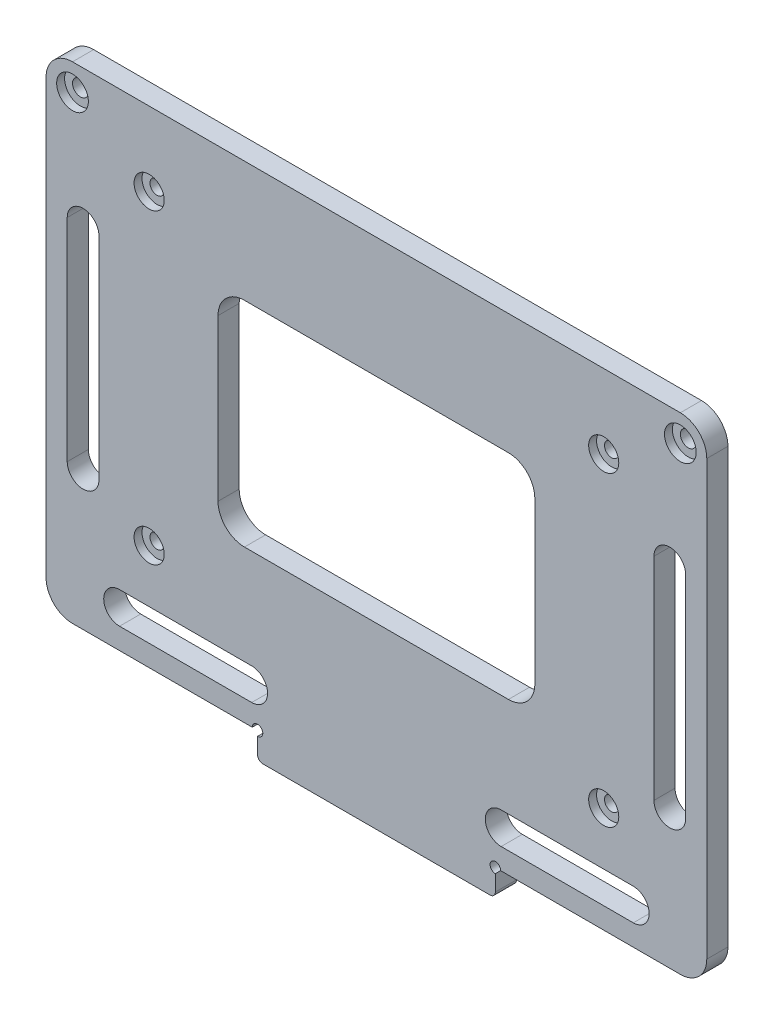
from build123d import *

# Parameters (mm, degrees)
SKETCH_1_W          = 45
SKETCH_1_H          = 5
EXTRUDE_1_DEPTH     = 4
SKETCH_2_W          = 125
SKETCH_2_H          = 92.025
SKETCH_2_R          = 1.5
SKETCH_2_R_2        = 1.35
SKETCH_2_W_2        = 59.93870536
SKETCH_2_H_2        = 40.423778034
SKETCH_2_W_3        = 45
SKETCH_2_H_3        = 5
EXTRUDE_2_DEPTH     = 4
CUT_EXTRUDE_1_DEPTH = 4
FILLET_1_R          = 5
FILLET_2_R          = 1
CUT_EXTRUDE_START   = -1.5
SKETCH_4_R          = 2.85
SKETCH_4_R_2        = 1.35
SKETCH_4_R_3        = 3
SKETCH_4_R_4        = 1.5
CUT_EXTRUDE_2_DEPTH = 1.5


with BuildPart() as part:
    # 草图1 → 凸台-拉伸1 (new body)
    with BuildSketch(Plane.XY):
        Rectangle(SKETCH_1_W, SKETCH_1_H)
    extrude(amount=EXTRUDE_1_DEPTH)

    # 草图2 → 凸台-拉伸2 (add)
    # profile 1 of 2: a face of its own
    with BuildSketch(Plane(origin=(0, 0, 0), x_dir=(-1, 0, 0), z_dir=(0, 0, -1))):
        with Locations((0, 48.5125)):
            Rectangle(SKETCH_2_W, SKETCH_2_H)
        with Locations((-57.5, 89.525)):
            Circle(SKETCH_2_R, mode=Mode.SUBTRACT)
        with Locations((57.5, 89.525)):
            Circle(SKETCH_2_R, mode=Mode.SUBTRACT)
        with Locations((-43, 80.5)):
            Circle(SKETCH_2_R_2, mode=Mode.SUBTRACT)
        with Locations((43, 80.5)):
            Circle(SKETCH_2_R_2, mode=Mode.SUBTRACT)
        with Locations((43, 22.5)):
            Circle(SKETCH_2_R_2, mode=Mode.SUBTRACT)
        with Locations((-43, 22.5)):
            Circle(SKETCH_2_R_2, mode=Mode.SUBTRACT)
        with BuildLine():
            Line((-52.5, 68.5125), (-52.5, 28.5125))
            ThreePointArc((-52.5, 28.5125), (-55.5, 25.5125), (-58.5, 28.5125))
            Line((-58.5, 28.5125), (-58.5, 68.5125))
            ThreePointArc((-58.5, 68.5125), (-55.5, 71.5125), (-52.5, 68.5125))
        make_face(mode=Mode.SUBTRACT)
        with BuildLine():
            Line((58.5, 68.5125), (58.5, 28.5125))
            ThreePointArc((58.5, 28.5125), (55.5, 25.5125), (52.5, 28.5125))
            Line((52.5, 28.5125), (52.5, 68.5125))
            ThreePointArc((52.5, 68.5125), (55.5, 71.5125), (58.5, 68.5125))
        make_face(mode=Mode.SUBTRACT)
        with Locations((0, 51.5)):
            Rectangle(SKETCH_2_W_2, SKETCH_2_H_2, mode=Mode.SUBTRACT)
        with BuildLine():
            Line((-48.597194221, 12.5), (-23.597194221, 12.5))
            ThreePointArc((-23.597194221, 12.5), (-20.597194221, 9.5), (-23.597194221, 6.5))
            Line((-23.597194221, 6.5), (-48.597194221, 6.5))
            ThreePointArc((-48.597194221, 6.5), (-51.597194221, 9.5), (-48.597194221, 12.5))
        make_face(mode=Mode.SUBTRACT)
        with BuildLine():
            Line((48.597194221, 12.5), (23.597194221, 12.5))
            ThreePointArc((23.597194221, 12.5), (20.597194221, 9.5), (23.597194221, 6.5))
            Line((23.597194221, 6.5), (48.597194221, 6.5))
            ThreePointArc((48.597194221, 6.5), (51.597194221, 9.5), (48.597194221, 12.5))
        make_face(mode=Mode.SUBTRACT)
    # profile 2 of 2: a face of its own
    with BuildSketch(Plane(origin=(0, 0, 0), x_dir=(-1, 0, 0), z_dir=(0, 0, -1))):
        Rectangle(SKETCH_2_W_3, SKETCH_2_H_3)
    extrude(amount=-EXTRUDE_2_DEPTH)

    # 草图3 → 切除-拉伸1 (cut)
    with BuildSketch(Plane(origin=(0, 0, 0), x_dir=(-1, 0, 0), z_dir=(0, 0, -1))):
        with BuildLine():
            Line((-23.5, 2.5), (-22.5, 2.5))
            Line((-22.5, 2.5), (-22.5, 1.5))
            ThreePointArc((-22.5, 1.5), (-21.792893219, 1.792893219), (-21.5, 2.5))
            ThreePointArc((-21.5, 2.5), (-22.5, 3.5), (-23.5, 2.5))
        make_face()
        with BuildLine():
            Line((-22.5, 1.5), (-22.5, 2.5))
            Line((-22.5, 2.5), (-23.5, 2.5))
            ThreePointArc((-23.5, 2.5), (-23.207106781, 1.792893219), (-22.5, 1.5))
        make_face()
        with BuildLine():
            ThreePointArc((23.5, 2.5), (21.792893219, 3.207106781), (22.5, 1.5))
            Line((22.5, 1.5), (22.5, 2.5))
            Line((22.5, 2.5), (23.5, 2.5))
        make_face()
        with BuildLine():
            Line((22.5, 2.5), (22.5, 1.5))
            ThreePointArc((22.5, 1.5), (23.207106781, 1.792893219), (23.5, 2.5))
            Line((23.5, 2.5), (22.5, 2.5))
        make_face()
    extrude(amount=-CUT_EXTRUDE_1_DEPTH, mode=Mode.SUBTRACT)

    # 圆角1
    fillet_1_edges = [part.edges().sort_by_distance(p)[0] for p in [
        (-62.5, 2.5, 2),
        (-29.96935268, 71.711889017, 2),
        (29.96935268, 71.711889017, 2),
        (29.96935268, 31.288110983, 2),
        (62.5, 94.525, 2),
        (-62.5, 94.525, 2),
        (-29.96935268, 31.288110983, 2),
        (62.5, 2.5, 2),
    ]]
    fillet(fillet_1_edges, radius=FILLET_1_R)

    # 圆角2
    fillet_2_edges = [part.edges().sort_by_distance(p)[0] for p in [
        (22.5, -2.5, 2),
        (-22.5, -2.5, 2),
    ]]
    fillet(fillet_2_edges, radius=FILLET_2_R)

    # 草图4 → 切除-拉伸2 (cut)
    # profile 1 of 6: a face of its own
    with BuildSketch(Plane.XY.offset(4).offset(CUT_EXTRUDE_START)):
        with Locations((43, 22.5)):
            Circle(SKETCH_4_R)
        with Locations(Location((43, 22.5, 0), (0, 0, 180))):
            Circle(SKETCH_4_R_2, mode=Mode.SUBTRACT)
    # profile 2 of 6: a face of its own
    with BuildSketch(Plane.XY.offset(4).offset(CUT_EXTRUDE_START)):
        with Locations((43, 80.5)):
            Circle(SKETCH_4_R)
        with Locations(Location((43, 80.5, 0), (0, 0, 180))):
            Circle(SKETCH_4_R_2, mode=Mode.SUBTRACT)
    # profile 3 of 6: a face of its own
    with BuildSketch(Plane.XY.offset(4).offset(CUT_EXTRUDE_START)):
        with Locations((-43, 22.5)):
            Circle(SKETCH_4_R)
        with Locations(Location((-43, 22.5, 0), (0, 0, 180))):
            Circle(SKETCH_4_R_2, mode=Mode.SUBTRACT)
    # profile 4 of 6: a face of its own
    with BuildSketch(Plane.XY.offset(4).offset(CUT_EXTRUDE_START)):
        with Locations((-43, 80.5)):
            Circle(SKETCH_4_R)
        with Locations(Location((-43, 80.5, 0), (0, 0, 180))):
            Circle(SKETCH_4_R_2, mode=Mode.SUBTRACT)
    # profile 5 of 6: a face of its own
    with BuildSketch(Plane.XY.offset(4).offset(CUT_EXTRUDE_START)):
        with Locations((57.5, 89.525)):
            Circle(SKETCH_4_R_3)
        with Locations(Location((57.5, 89.525, 0), (0, 0, 180))):
            Circle(SKETCH_4_R_4, mode=Mode.SUBTRACT)
    # profile 6 of 6: a face of its own
    with BuildSketch(Plane.XY.offset(4).offset(CUT_EXTRUDE_START)):
        with Locations((-57.5, 89.525)):
            Circle(SKETCH_4_R_3)
        with Locations(Location((-57.5, 89.525, 0), (0, 0, 180))):
            Circle(SKETCH_4_R_4, mode=Mode.SUBTRACT)
    extrude(amount=CUT_EXTRUDE_2_DEPTH, mode=Mode.SUBTRACT)


solid = part.part
